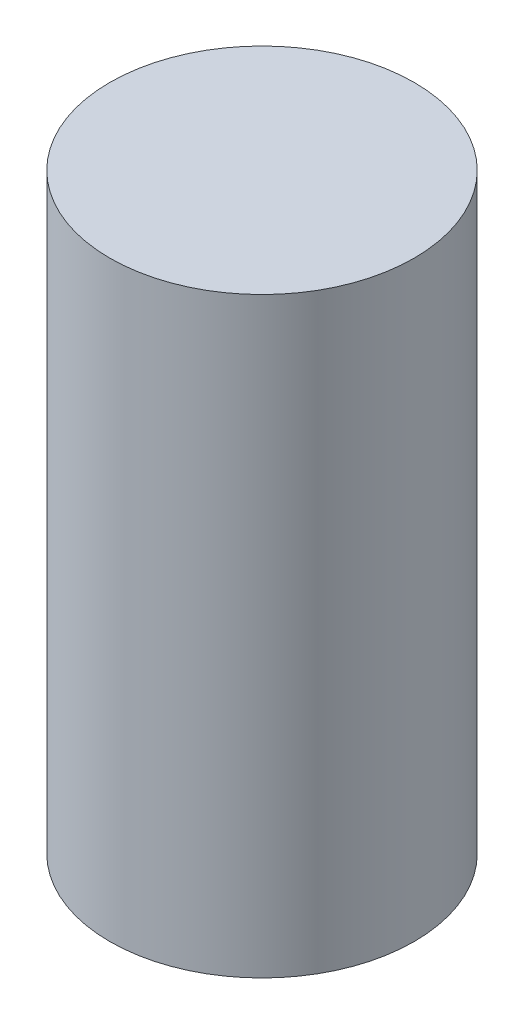
from build123d import *

# Parameters (mm, degrees)
SKETCH_1_R      = 9
EXTRUDE_1_DEPTH = 35


with BuildPart() as part:
    # 草图1 → 凸台-拉伸1 (new body)
    with BuildSketch(Plane(origin=(0, 0, 0), x_dir=(1, 0, 0), z_dir=(0, 1, 0))):
        with Locations(Location((0, 0, 0), (0, 0, 270))):
            Circle(SKETCH_1_R)
    extrude(amount=EXTRUDE_1_DEPTH)


solid = part.part
